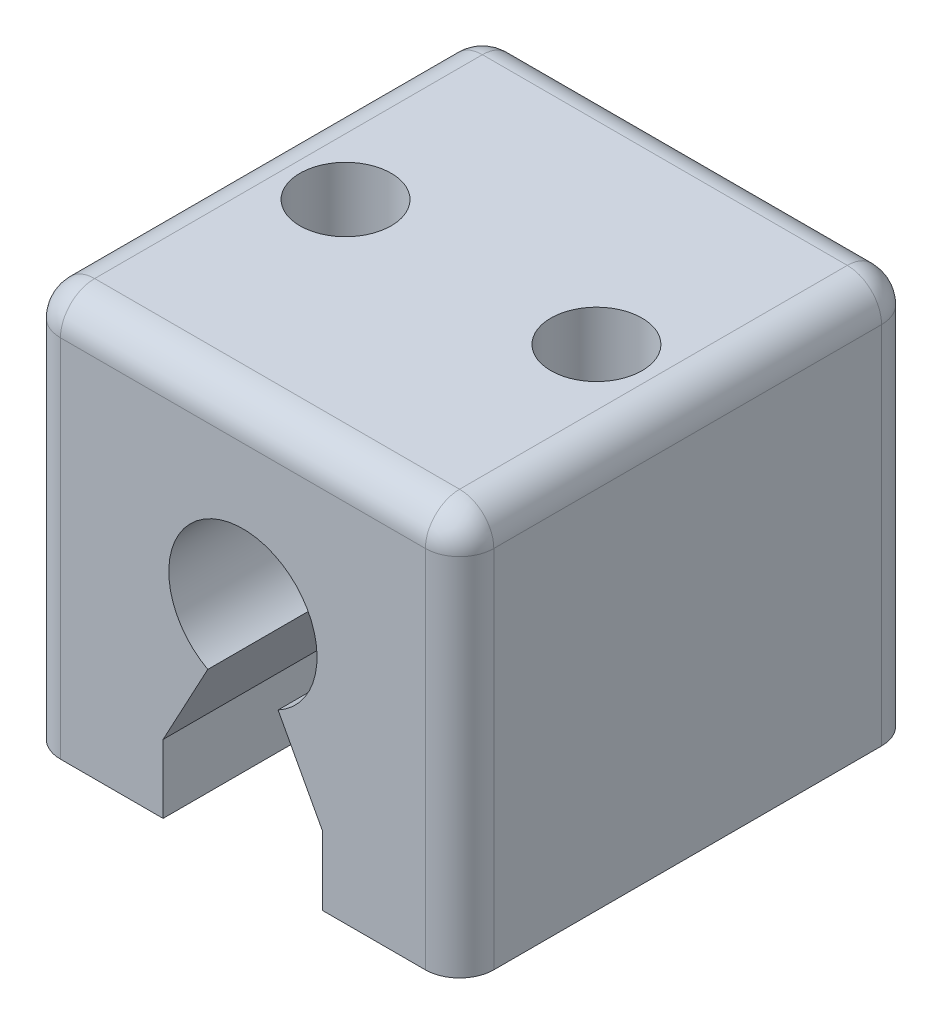
from build123d import *

# Parameters (mm, degrees)
BOSS_EXTRUDE1_DEPTH = 40
SHELL1_T            = 4
SKETCH2_W           = 38
SKETCH2_H           = 8
CUT_EXTRUDE1_DEPTH  = 50.505693367
BOSS_EXTRUDE2_DEPTH = 40
SKETCH4_R           = 2.1
CUT_EXTRUDE2_DEPTH  = 57.708559772
SKETCH5_R           = 4
CUT_EXTRUDE4_DEPTH  = 28
LPATTERN1_COUNT     = 2
LPATTERN1_PITCH     = 22
FILLET1_R           = 3


with BuildPart() as part:
    # Sketch1 → Boss-Extrude1 (new body)
    with BuildSketch(Plane.XY):
        with BuildLine():
            Line((-15.770198569, -12.053486897), (14.229801431, -12.053486897))
            Line((14.229801431, -12.053486897), (14.229801431, -8.053486897))
            Line((14.229801431, -8.053486897), (6.229801431, -8.053486897))
            Line((6.229801431, -8.053486897), (6.229801431, -2.053486897))
            Line((6.229801431, -2.053486897), (2.31145028, 5.223450953))
            ThreePointArc((2.31145028, 5.223450953), (-0.770198569, 17.446513103), (-3.851847419, 5.223450953))
            Line((-3.851847419, 5.223450953), (-7.770198569, -2.053486897))
            Line((-7.770198569, -2.053486897), (-7.770198569, -8.053486897))
            Line((-7.770198569, -8.053486897), (-15.770198569, -8.053486897))
            Line((-15.770198569, -8.053486897), (-15.770198569, -12.053486897))
        make_face()
    extrude(amount=BOSS_EXTRUDE1_DEPTH)

    # Shell1
    shell1_openings = [part.faces().sort_by_distance(p)[0] for p in [
        (-0.770198569, -0.27560318, 0),
        (-0.770198569, -0.27560318, 40),
    ]]
    offset(amount=SHELL1_T, openings=shell1_openings, kind=Kind.INTERSECTION)

    # Sketch2 → Cut-Extrude1 (cut, through all)
    with BuildSketch(Plane.XY.offset(40)):
        with Locations((-0.770198569, -12.053486897)):
            Rectangle(SKETCH2_W, SKETCH2_H)
    extrude(amount=-CUT_EXTRUDE1_DEPTH, mode=Mode.SUBTRACT)

    # Sketch3 → Boss-Extrude2 (add, through all)
    with BuildSketch(Plane.XY.offset(40)):
        Polygon((-19.770198569, 26.946513103), (18.229801431, 26.946513103), (18.229801431, -8.053486897), (6.229801431, -8.053486897), (6.229801431, 17.511933237), (-7.770198569, 17.511933237), (-7.770198569, -8.053486897), (-19.770198569, -8.053486897), align=None)
    extrude(amount=-BOSS_EXTRUDE2_DEPTH)

    # Sketch4 → Cut-Extrude2 (cut, through all)
    with BuildSketch(Plane.XZ.offset(8.053486897)):
        with Locations(Location((-11.770198569, 20, 0), (0, 0, 270))):
            Circle(SKETCH4_R)
    cut_extrude2 = extrude(amount=-CUT_EXTRUDE2_DEPTH, mode=Mode.SUBTRACT)

    # Sketch5 → Cut-Extrude4 (cut)
    with BuildSketch(Plane(origin=(0, 26.946513103, 0), x_dir=(1, 0, 0), z_dir=(0, 1, 0))):
        with Locations(Location((-11.770198569, -20, 0), (0, 0, 270))):
            Circle(SKETCH5_R)
    cut_extrude4 = extrude(amount=-CUT_EXTRUDE4_DEPTH, mode=Mode.SUBTRACT)

    # LPattern1: Cut-Extrude2, Cut-Extrude4 ×2
    with Locations(*[(i * LPATTERN1_PITCH, 0, 0) for i in range(1, LPATTERN1_COUNT)]):
        add(cut_extrude2, mode=Mode.SUBTRACT)
        add(cut_extrude4, mode=Mode.SUBTRACT)

    # Fillet1
    fillet1_edges = [part.edges().sort_by_distance(p)[0] for p in [
        (-0.770198569, 26.946513103, 40),
        (-19.770198569, 26.946513103, 20),
        (18.229801431, 26.946513103, 20),
        (-0.770198569, 26.946513103, 0),
        (-19.770198569, 9.446513103, 0),
        (-19.770198569, 9.446513103, 40),
        (18.229801431, 9.446513103, 0),
        (18.229801431, 9.446513103, 40),
    ]]
    fillet(fillet1_edges, radius=FILLET1_R)


solid = part.part
